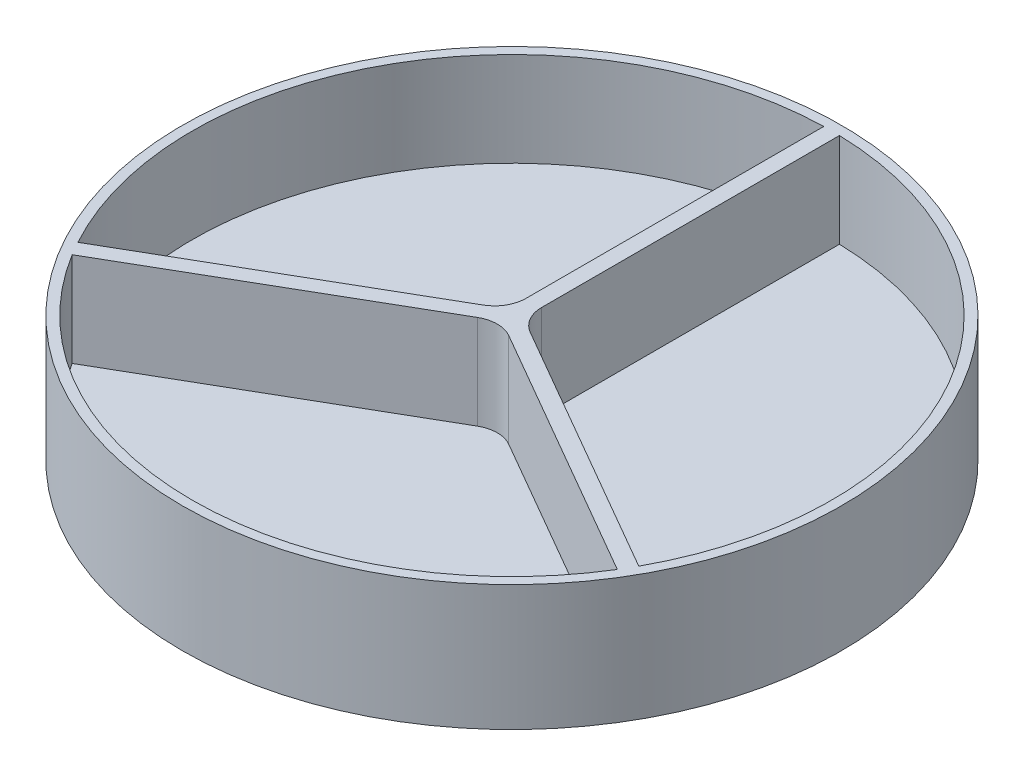
from build123d import *

# Parameters (mm, degrees)
BOSS_EXTRUDE2_DEPTH   = 8
BOSS_EXTRUDE2_2_DEPTH = 8
BOSS_EXTRUDE2_3_DEPTH = 8
SKETCH2_4_R           = 84
BOSS_EXTRUDE3_DEPTH   = 32
SKETCH4_R             = 2.95
CUT_EXTRUDE2_DEPTH    = 8


with BuildPart() as part:
    # Sketch2 → Boss-Extrude2 (new body)
    with BuildSketch(Plane(origin=(0, 0, 0), x_dir=(1, 0, 0), z_dir=(0, 1, 0))):
        with BuildLine():
            Line((-2, 5.579606434), (-2, 81.475456427))
            ThreePointArc((-2, 81.475456427), (-70.623024312, 40.677247166), (-71.479275287, -39.15307401))
            Line((-71.479275287, -39.15307401), (-6, -1.348596796))
            ThreePointArc((-6, -1.348596796), (-3.07179677, 1.579606434), (-2, 5.579606434))
        make_face()
    extrude(amount=BOSS_EXTRUDE2_DEPTH)



with BuildPart() as body_2:
    # Sketch2 → Boss-Extrude2 2 (new body)
    with BuildSketch(Plane(origin=(0, 0, 0), x_dir=(1, 0, 0), z_dir=(0, 1, 0))):
        with BuildLine():
            ThreePointArc((71.479275287, -39.15307401), (70.623024312, 40.677247166), (2, 81.475456427))
            Line((2, 81.475456427), (2, 5.579606434))
            ThreePointArc((2, 5.579606434), (3.07179677, 1.579606434), (6, -1.348596796))
            Line((6, -1.348596796), (71.479275287, -39.15307401))
        make_face()
    extrude(amount=BOSS_EXTRUDE2_2_DEPTH)


with BuildPart() as body_3:
    # Sketch2 → Boss-Extrude2 3 (new body)
    with BuildSketch(Plane(origin=(0, 0, 0), x_dir=(1, 0, 0), z_dir=(0, 1, 0))):
        with BuildLine():
            Line((-4, -4.812698411), (-69.472135836, -42.613053661))
            ThreePointArc((-69.472135836, -42.613053661), (0, -81.5), (69.472135836, -42.613053661))
            Line((69.472135836, -42.613053661), (4, -4.812698411))
            ThreePointArc((4, -4.812698411), (0, -3.740901642), (-4, -4.812698411))
        make_face()
    extrude(amount=BOSS_EXTRUDE2_3_DEPTH)


with BuildPart() as part_1:
    add(part.part)

    add(body_2.part)  # Boss-Extrude3 merges body 2

    add(body_3.part)  # Boss-Extrude3 merges body 3
    # Sketch2<4> → Boss-Extrude3 (add)
    with BuildSketch(Plane(origin=(0, 0, 0), x_dir=(1, 0, 0), z_dir=(0, 1, 0))):
        Circle(SKETCH2_4_R)
        with BuildLine():
            Line((2, 5.579606434), (2, 81.475456427))
            ThreePointArc((2, 81.475456427), (70.623024312, 40.677247166), (71.479275287, -39.15307401))
            Line((71.479275287, -39.15307401), (6, -1.348596796))
            ThreePointArc((6, -1.348596796), (3.07179677, 1.579606434), (2, 5.579606434))
        make_face(mode=Mode.SUBTRACT)
        with BuildLine():
            Line((4, -4.812698411), (69.472135836, -42.613053661))
            ThreePointArc((69.472135836, -42.613053661), (0, -81.5), (-69.472135836, -42.613053661))
            Line((-69.472135836, -42.613053661), (-4, -4.812698411))
            ThreePointArc((-4, -4.812698411), (0, -3.740901642), (4, -4.812698411))
        make_face(mode=Mode.SUBTRACT)
        with BuildLine():
            Line((-6, -1.348596796), (-71.479275287, -39.15307401))
            ThreePointArc((-71.479275287, -39.15307401), (-70.623024312, 40.677247166), (-2, 81.475456427))
            Line((-2, 81.475456427), (-2, 5.579606434))
            ThreePointArc((-2, 5.579606434), (-3.07179677, 1.579606434), (-6, -1.348596796))
        make_face(mode=Mode.SUBTRACT)
    extrude(amount=BOSS_EXTRUDE3_DEPTH)

    # Sketch4 → Cut-Extrude2 (cut)
    with BuildSketch(Plane(origin=(0, 0, 0), x_dir=(1, 0, 0), z_dir=(0, 1, 0))):
        Circle(SKETCH4_R)
    extrude(amount=CUT_EXTRUDE2_DEPTH, mode=Mode.SUBTRACT)


solid = part_1.part
